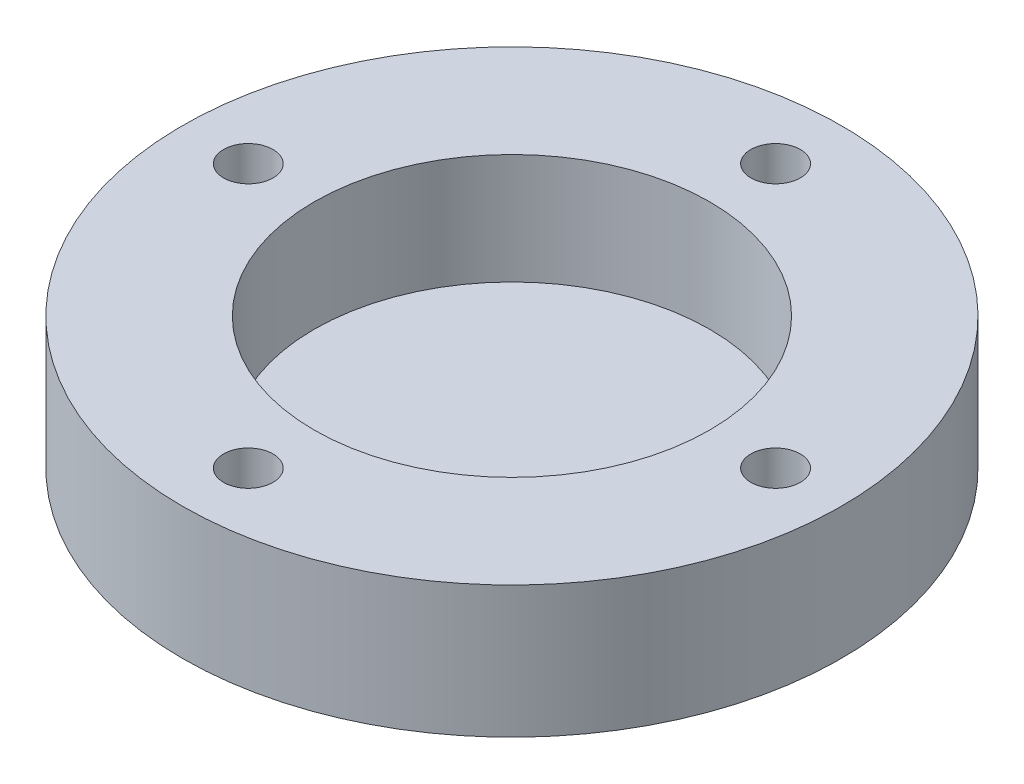
from build123d import *

# Parameters (mm, degrees)
SKETCH2_R           = 20
BOSS_EXTRUDE1_DEPTH = 8
SKETCH3_R           = 1.5
CUT_EXTRUDE1_DEPTH  = 30.393876913
SKETCH4_R           = 12
CUT_EXTRUDE2_DEPTH  = 6.7


with BuildPart() as part:
    # Sketch2 → Boss-Extrude1 (new body)
    with BuildSketch(Plane(origin=(0, 0, 0), x_dir=(1, 0, 0), z_dir=(0, 1, 0))):
        with Locations(Location((0, 0, 0), (0, 0, 270))):
            Circle(SKETCH2_R)
    extrude(amount=BOSS_EXTRUDE1_DEPTH)

    # Sketch3 → Cut-Extrude1 (cut, through all)
    with BuildSketch(Plane(origin=(0, 8, 0), x_dir=(1, 0, 0), z_dir=(0, 1, 0))):
        with Locations(Location((0, 16, 0), (0, 0, 270))):
            Circle(SKETCH3_R)
        with Locations(Location((-16, 0, 0), (0, 0, 270))):
            Circle(SKETCH3_R)
        with Locations(Location((16, 0, 0), (0, 0, 270))):
            Circle(SKETCH3_R)
        with Locations(Location((0, -16, 0), (0, 0, 270))):
            Circle(SKETCH3_R)
    extrude(amount=-CUT_EXTRUDE1_DEPTH, mode=Mode.SUBTRACT)

    # Sketch4 → Cut-Extrude2 (cut)
    with BuildSketch(Plane(origin=(0, 8, -8), x_dir=(1, 0, 0), z_dir=(0, -1, 0))):
        with Locations(Location((0, 8, 0), (0, 0, 270))):
            Circle(SKETCH4_R)
    extrude(amount=CUT_EXTRUDE2_DEPTH, mode=Mode.SUBTRACT)


solid = part.part
